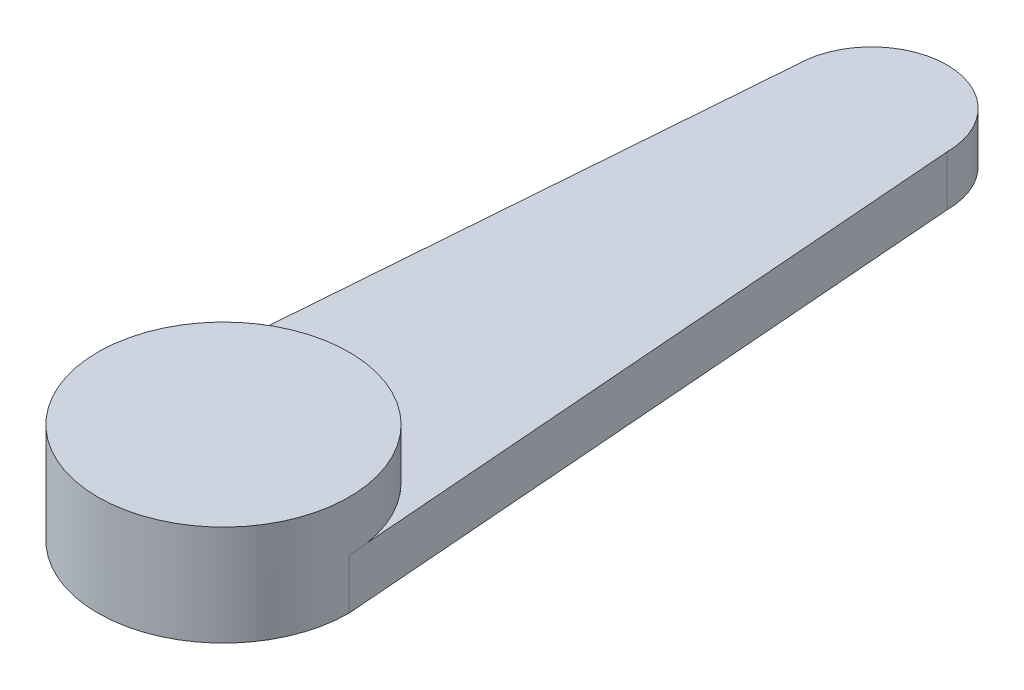
from build123d import *

# Parameters (mm, degrees)
SKETCH1_R           = 2.38125
BOSS_EXTRUDE1_DEPTH = 1.5875
SKETCH2_R           = 3.96875
BOSS_EXTRUDE2_DEPTH = 1.5875


with BuildPart() as part:
    # Sketch1 → Boss-Extrude1 (new body)
    with BuildSketch(Plane(origin=(0, 0, 0), x_dir=(1, 0, 0), z_dir=(0, 1, 0))):
        with BuildLine():
            Line((3.96875, 0), (3.921336464, 0.61163461))
            ThreePointArc((3.921336464, 0.61163461), (0, 3.96875), (-3.921336464, 0.61163461))
            Line((-3.921336464, 0.61163461), (-3.96875, 0))
            ThreePointArc((-3.96875, 0), (0, -3.96875), (3.96875, 0))
        make_face()
        with BuildLine():
            Line((3.921336464, 0.61163461), (2.38125, 20.47875))
            ThreePointArc((2.38125, 20.47875), (0, 18.0975), (-2.38125, 20.47875))
            Line((-2.38125, 20.47875), (-3.921336464, 0.61163461))
            ThreePointArc((-3.921336464, 0.61163461), (0, 3.96875), (3.921336464, 0.61163461))
        make_face()
        with Locations((0, 20.47875)):
            Circle(SKETCH1_R)
    extrude(amount=BOSS_EXTRUDE1_DEPTH)

    # Sketch2 → Boss-Extrude2 (add)
    with BuildSketch(Plane(origin=(0, 1.5875, 0), x_dir=(1, 0, 0), z_dir=(0, 1, 0))):
        with Locations(Location((0, 0, 0), (0, 0, 8.865336937))):
            Circle(SKETCH2_R)
    extrude(amount=BOSS_EXTRUDE2_DEPTH)


solid = part.part
